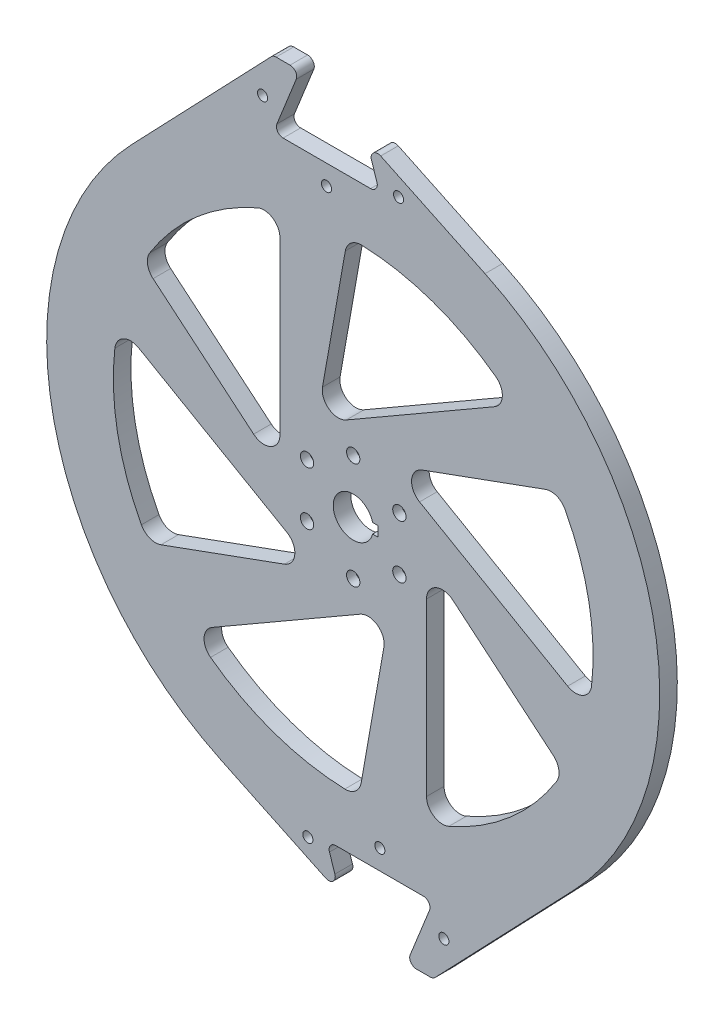
from build123d import *

# Parameters (mm, degrees)
EXTRUDE1_DEPTH               = 4.191
SKETCH2_R                    = 9.525
SKETCH2_R_2                  = 3.175
CUT_EXTRUDE1_DEPTH           = 226.3795974
CIRPATTERN1_COUNT            = 6
CUT_EXTRUDE2_DEPTH           = 226.3795974
CIRPATTERN2_COUNT            = 6
SKETCH5_R                    = 2.413
CUT_EXTRUDE3_DEPTH           = 226.3795974
CIRPATTERN3_COUNT            = 2
CIRPATTERN3_ANGLE            = 180
MIRROR1_COPY_1_SKETCH_R      = 2.413
MIRROR1_COPY_1_DEPTH         = 226.3795974
MIRROR1_COPY_2_SKETCH_R      = 2.413
MIRROR1_COPY_2_DEPTH         = 226.3795974
SKETCH7_W                    = 4.7625
SKETCH7_H                    = 4.7625
CUT_EXTRUDE5_DEPTH           = 226.3795974
SKETCH8_R                    = 6.7437
CUT_EXTRUDE6_DEPTH           = 226.3795974
CUT_EXTRUDE6_DRAFT           = -41
CUT_EXTRUDE6_PROFILE_2_DEPTH = 226.3795974
CUT_EXTRUDE6_PROFILE_2_DRAFT = -41
CUT_EXTRUDE6_PROFILE_3_DEPTH = 226.3795974
CUT_EXTRUDE6_PROFILE_3_DRAFT = -41
CUT_EXTRUDE6_PROFILE_4_DEPTH = 226.3795974
CUT_EXTRUDE6_PROFILE_4_DRAFT = -41
CUT_EXTRUDE6_PROFILE_5_DEPTH = 226.3795974
CUT_EXTRUDE6_PROFILE_5_DRAFT = -41
CUT_EXTRUDE6_PROFILE_6_DEPTH = 226.3795974
CUT_EXTRUDE6_PROFILE_6_DRAFT = -41
FILLET1_R                    = 3.175


with BuildPart() as part:
    # Sketch1 → Extrude1 (new, symmetric)
    with BuildSketch(Plane.XY):
        with BuildLine():
            Line((-105.534368849, 100.960880996), (-38.1, 171.45))
            Line((-38.1, 171.45), (-25.4, 171.45))
            Line((-25.4, 171.45), (-38.1, 139.7))
            Line((-38.1, 139.7), (12.7, 139.7))
            Line((12.7, 139.7), (6.35, 158.75))
            Line((6.35, 158.75), (62.811169407, 131.853553224))
            ThreePointArc((62.811169407, 131.853553224), (143.651297446, 26.361093338), (105.534368849, -100.960880996))
            Line((105.534368849, -100.960880996), (38.1, -171.45))
            Line((38.1, -171.45), (25.4, -171.45))
            Line((25.4, -171.45), (38.1, -139.7))
            Line((38.1, -139.7), (-12.7, -139.7))
            Line((-12.7, -139.7), (-6.35, -158.75))
            Line((-6.35, -158.75), (-62.811169407, -131.853553224))
            ThreePointArc((-62.811169407, -131.853553224), (-143.651297446, -26.361093338), (-105.534368849, 100.960880996))
        make_face()
    extrude(amount=EXTRUDE1_DEPTH, both=True)

    # Sketch2 → Cut-Extrude1 (cut, through all)
    with BuildSketch(Plane.XY.offset(4.191)):
        Circle(SKETCH2_R)
        with Locations((0, 25.4)):
            Circle(SKETCH2_R_2)
    cut_extrude1 = extrude(amount=-CUT_EXTRUDE1_DEPTH, mode=Mode.SUBTRACT)

    # CirPattern1: Cut-Extrude1 ×6 about axis
    cirpattern1_axis = Axis((0, 0, 0), (0, 0, 1))
    for i in range(1, CIRPATTERN1_COUNT):
        add(cut_extrude1.rotate(cirpattern1_axis, i * 360 / CIRPATTERN1_COUNT), mode=Mode.SUBTRACT)

    # Sketch4 → Cut-Extrude2 (cut, through all)
    with BuildSketch(Plane.XY.offset(4.191)):
        with BuildLine():
            Line((-34.925, 97.829164235), (-34.925, 16.341142734))
            ThreePointArc((-34.925, 16.341142734), (-39.324648846, 9.435077397), (-47.443041586, 10.503884078))
            Line((-47.443041586, 10.503884078), (-95.358377503, 50.709624774))
            ThreePointArc((-95.358377503, 50.709624774), (-97.986620506, 55.355480776), (-96.921788483, 60.585946533))
            ThreePointArc((-96.921788483, 60.585946533), (-74.606068946, 86.593443611), (-45.583928571, 104.816961681))
            ThreePointArc((-45.583928571, 104.816961681), (-38.367215642, 104.201802453), (-34.925, 97.829164235))
        make_face()
    cut_extrude2 = extrude(amount=-CUT_EXTRUDE2_DEPTH, mode=Mode.SUBTRACT)

    # CirPattern2: Cut-Extrude2 ×6 about axis
    cirpattern2_axis = Axis((0, 0, 0), (0, 0, 1))
    for i in range(1, CIRPATTERN2_COUNT):
        add(cut_extrude2.rotate(cirpattern2_axis, i * 360 / CIRPATTERN2_COUNT), mode=Mode.SUBTRACT)

    # Sketch5 → Cut-Extrude3 (cut, through all)
    with BuildSketch(Plane.XY.offset(4.191)):
        with Locations((21.59, 142.875)):
            Circle(SKETCH5_R)
        with Locations((-12.7, 130.175)):
            Circle(SKETCH5_R)
        with Locations((-43.18, 152.4)):
            Circle(SKETCH5_R)
    cut_extrude3 = extrude(amount=-CUT_EXTRUDE3_DEPTH, mode=Mode.SUBTRACT)

    # CirPattern3: Cut-Extrude3 ×2 about axis
    cirpattern3_axis = Axis((0, 0, 0), (0, 0, 1))
    for i in range(1, CIRPATTERN3_COUNT):
        add(cut_extrude3.rotate(cirpattern3_axis, i * CIRPATTERN3_ANGLE / (CIRPATTERN3_COUNT - 1)), mode=Mode.SUBTRACT)

    # Mirror1 copy 1 sketch → Mirror1 copy 1 (cut, through all)
    with BuildSketch(Plane(origin=(0, 0, -4.191), x_dir=(-1, 0, 0), z_dir=(0, 0, -1))):
        with Locations((21.59, -142.875)):
            Circle(MIRROR1_COPY_1_SKETCH_R)
        with Locations((-12.7, -130.175)):
            Circle(MIRROR1_COPY_1_SKETCH_R)
        with Locations((-43.18, -152.4)):
            Circle(MIRROR1_COPY_1_SKETCH_R)
    extrude(amount=-MIRROR1_COPY_1_DEPTH, mode=Mode.SUBTRACT)

    # Mirror1 copy 2 sketch → Mirror1 copy 2 (cut, through all)
    with BuildSketch(Plane(origin=(0, 0, -4.191), x_dir=(1, 0, 0), z_dir=(0, 0, -1))):
        with Locations((21.59, -142.875)):
            Circle(MIRROR1_COPY_2_SKETCH_R)
        with Locations((-12.7, -130.175)):
            Circle(MIRROR1_COPY_2_SKETCH_R)
        with Locations((-43.18, -152.4)):
            Circle(MIRROR1_COPY_2_SKETCH_R)
    extrude(amount=-MIRROR1_COPY_2_DEPTH, mode=Mode.SUBTRACT)

    # Sketch7 → Cut-Extrude5 (cut, through all)
    with BuildSketch(Plane.XY.offset(4.191)):
        with Locations((9.525, 0)):
            Rectangle(SKETCH7_W, SKETCH7_H)
    extrude(amount=-CUT_EXTRUDE5_DEPTH, mode=Mode.SUBTRACT)


with BuildPart() as cut_extrude6_tool:
    # Sketch8 → Cut-Extrude6 (with draft: the straight prism first)
    with BuildSketch(Plane(origin=(0, 0, -4.191), x_dir=(-1, 0, 0), z_dir=(0, 0, -1))):
        with Locations((0, 25.4)):
            Circle(SKETCH8_R)
    extrude(amount=-CUT_EXTRUDE6_DEPTH)
    # Cut-Extrude6: the draft: its side faces are tilted about the plane it starts from
    cut_extrude6_sides = [cut_extrude6_tool.faces().sort_by_distance(p)[0] for p in [
        (6.7437, 25.4, 108.9987987),
    ]]
    draft(cut_extrude6_sides, Plane(origin=(0, 0, -4.191), x_dir=(-1, 0, 0), z_dir=(0, 0, -1)), CUT_EXTRUDE6_DRAFT)


with BuildPart() as part_1:
    add(part.part)

    # Cut-Extrude6: cut by cut_extrude6_tool
    add(cut_extrude6_tool.part, mode=Mode.SUBTRACT)


with BuildPart() as cut_extrude6_profile_2_tool:
    # Sketch8 → Cut-Extrude6 profile 2 (with draft: the straight prism first)
    with BuildSketch(Plane(origin=(0, 0, -4.191), x_dir=(-1, 0, 0), z_dir=(0, 0, -1))):
        with Locations((-21.997045256, 12.7)):
            Circle(SKETCH8_R)
    extrude(amount=-CUT_EXTRUDE6_PROFILE_2_DEPTH)
    # Cut-Extrude6 profile 2: the draft: its side faces are tilted about the plane it starts from
    cut_extrude6_profile_2_sides = [cut_extrude6_profile_2_tool.faces().sort_by_distance(p)[0] for p in [
        (28.740745256, 12.7, 108.9987987),
    ]]
    draft(cut_extrude6_profile_2_sides, Plane(origin=(0, 0, -4.191), x_dir=(-1, 0, 0), z_dir=(0, 0, -1)), CUT_EXTRUDE6_PROFILE_2_DRAFT)


with BuildPart() as part_2:
    add(part_1.part)

    # Cut-Extrude6 profile 2: cut by cut_extrude6_profile_2_tool
    add(cut_extrude6_profile_2_tool.part, mode=Mode.SUBTRACT)


with BuildPart() as cut_extrude6_profile_3_tool:
    # Sketch8 → Cut-Extrude6 profile 3 (with draft: the straight prism first)
    with BuildSketch(Plane(origin=(0, 0, -4.191), x_dir=(-1, 0, 0), z_dir=(0, 0, -1))):
        with Locations((21.997045256, 12.7)):
            Circle(SKETCH8_R)
    extrude(amount=-CUT_EXTRUDE6_PROFILE_3_DEPTH)
    # Cut-Extrude6 profile 3: the draft: its side faces are tilted about the plane it starts from
    cut_extrude6_profile_3_sides = [cut_extrude6_profile_3_tool.faces().sort_by_distance(p)[0] for p in [
        (-15.253345256, 12.7, 108.9987987),
    ]]
    draft(cut_extrude6_profile_3_sides, Plane(origin=(0, 0, -4.191), x_dir=(-1, 0, 0), z_dir=(0, 0, -1)), CUT_EXTRUDE6_PROFILE_3_DRAFT)


with BuildPart() as part_3:
    add(part_2.part)

    # Cut-Extrude6 profile 3: cut by cut_extrude6_profile_3_tool
    add(cut_extrude6_profile_3_tool.part, mode=Mode.SUBTRACT)


with BuildPart() as cut_extrude6_profile_4_tool:
    # Sketch8 → Cut-Extrude6 profile 4 (with draft: the straight prism first)
    with BuildSketch(Plane(origin=(0, 0, -4.191), x_dir=(-1, 0, 0), z_dir=(0, 0, -1))):
        with Locations((21.997045256, -12.7)):
            Circle(SKETCH8_R)
    extrude(amount=-CUT_EXTRUDE6_PROFILE_4_DEPTH)
    # Cut-Extrude6 profile 4: the draft: its side faces are tilted about the plane it starts from
    cut_extrude6_profile_4_sides = [cut_extrude6_profile_4_tool.faces().sort_by_distance(p)[0] for p in [
        (-15.253345256, -12.7, 108.9987987),
    ]]
    draft(cut_extrude6_profile_4_sides, Plane(origin=(0, 0, -4.191), x_dir=(-1, 0, 0), z_dir=(0, 0, -1)), CUT_EXTRUDE6_PROFILE_4_DRAFT)


with BuildPart() as part_4:
    add(part_3.part)

    # Cut-Extrude6 profile 4: cut by cut_extrude6_profile_4_tool
    add(cut_extrude6_profile_4_tool.part, mode=Mode.SUBTRACT)


with BuildPart() as cut_extrude6_profile_5_tool:
    # Sketch8 → Cut-Extrude6 profile 5 (with draft: the straight prism first)
    with BuildSketch(Plane(origin=(0, 0, -4.191), x_dir=(-1, 0, 0), z_dir=(0, 0, -1))):
        with Locations((0, -25.4)):
            Circle(SKETCH8_R)
    extrude(amount=-CUT_EXTRUDE6_PROFILE_5_DEPTH)
    # Cut-Extrude6 profile 5: the draft: its side faces are tilted about the plane it starts from
    cut_extrude6_profile_5_sides = [cut_extrude6_profile_5_tool.faces().sort_by_distance(p)[0] for p in [
        (6.7437, -25.4, 108.9987987),
    ]]
    draft(cut_extrude6_profile_5_sides, Plane(origin=(0, 0, -4.191), x_dir=(-1, 0, 0), z_dir=(0, 0, -1)), CUT_EXTRUDE6_PROFILE_5_DRAFT)


with BuildPart() as part_5:
    add(part_4.part)

    # Cut-Extrude6 profile 5: cut by cut_extrude6_profile_5_tool
    add(cut_extrude6_profile_5_tool.part, mode=Mode.SUBTRACT)


with BuildPart() as cut_extrude6_profile_6_tool:
    # Sketch8 → Cut-Extrude6 profile 6 (with draft: the straight prism first)
    with BuildSketch(Plane(origin=(0, 0, -4.191), x_dir=(-1, 0, 0), z_dir=(0, 0, -1))):
        with Locations((-21.997045256, -12.7)):
            Circle(SKETCH8_R)
    extrude(amount=-CUT_EXTRUDE6_PROFILE_6_DEPTH)
    # Cut-Extrude6 profile 6: the draft: its side faces are tilted about the plane it starts from
    cut_extrude6_profile_6_sides = [cut_extrude6_profile_6_tool.faces().sort_by_distance(p)[0] for p in [
        (28.740745256, -12.7, 108.9987987),
    ]]
    draft(cut_extrude6_profile_6_sides, Plane(origin=(0, 0, -4.191), x_dir=(-1, 0, 0), z_dir=(0, 0, -1)), CUT_EXTRUDE6_PROFILE_6_DRAFT)


with BuildPart() as part_6:
    add(part_5.part)

    # Cut-Extrude6 profile 6: cut by cut_extrude6_profile_6_tool
    add(cut_extrude6_profile_6_tool.part, mode=Mode.SUBTRACT)

    # Fillet1
    fillet1_edges = [part_6.edges().sort_by_distance(p)[0] for p in [
        (-38.1, 171.45, 0),
        (-25.4, 171.45, 0),
        (-38.1, 139.7, 0),
        (12.7, 139.7, 0),
        (6.35, 158.75, 0),
        (38.1, -171.45, 0),
        (25.4, -171.45, 0),
        (38.1, -139.7, 0),
        (-12.7, -139.7, 0),
        (-6.35, -158.75, 0),
    ]]
    fillet(fillet1_edges, radius=FILLET1_R)


solid = part_6.part
